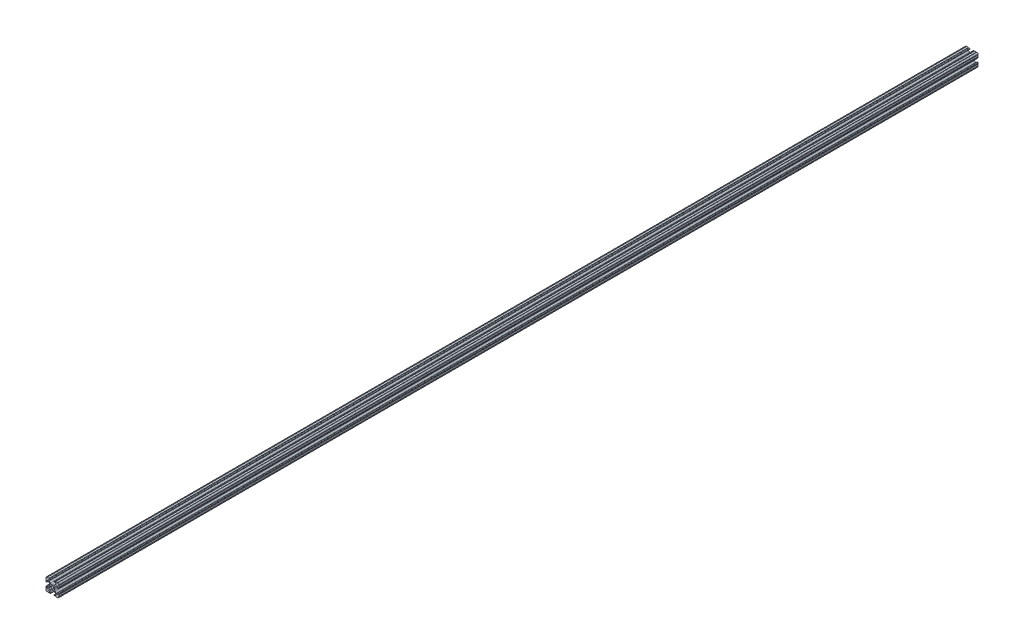
from build123d import *

# Parameters (mm, degrees)
SKETCH1_R               = 2.6035
BOSS_EXTRUDE1_DEPTH     = 914.4
CUT_EXTRUDE1_DEPTH      = 915.65008745
CUT_EXTRUDE1_DEPTH_BACK = 915.65008745
SKETCH2_R               = 3.175


with BuildPart() as part:
    # Sketch1 → Boss-Extrude1 (new, symmetric)
    with BuildSketch(Plane.XY):
        with BuildLine():
            Line((-7.179650497, -8.645192506), (-3.952270251, -5.423690499))
            ThreePointArc((-3.952270251, -5.423690499), (-2.922936451, -4.736929036), (-1.709253557, -4.4958))
            Line((-1.709253557, -4.4958), (1.709253557, -4.4958))
            ThreePointArc((1.709253557, -4.4958), (2.922936451, -4.736929036), (3.952270251, -5.423690499))
            Line((3.952270251, -5.423690499), (7.179650497, -8.645192506))
            ThreePointArc((7.179650497, -8.645192506), (7.41473083, -9.822813117), (6.416408329, -10.4902))
            Line((6.416408329, -10.4902), (4.287512407, -10.4902))
            ThreePointArc((4.287512407, -10.4902), (3.54574862, -10.79744862), (3.2385, -11.539212407))
            Line((3.2385, -11.539212407), (3.2385, -11.650987593))
            ThreePointArc((3.2385, -11.650987593), (3.54574862, -12.39275138), (4.287512407, -12.7))
            Line((4.287512407, -12.7), (5.317126718, -12.7))
            ThreePointArc((5.317126718, -12.7), (5.825126718, -12.192), (6.333126718, -12.7))
            Line((6.333126718, -12.7), (9.550443118, -12.7))
            ThreePointArc((9.550443118, -12.7), (10.058366869, -12.192000006), (10.566443095, -12.699847501))
            ThreePointArc((10.566443095, -12.699847501), (12.082537762, -12.08250727), (12.699846982, -10.566399977))
            ThreePointArc((12.699846982, -10.566399977), (12.192000006, -10.058323491), (12.7, -9.5504))
            Line((12.7, -9.5504), (12.7, -6.3330836))
            ThreePointArc((12.7, -6.3330836), (12.192, -5.8250836), (12.7, -5.3170836))
            Line((12.7, -5.3170836), (12.7, -4.287469289))
            ThreePointArc((12.7, -4.287469289), (12.39275138, -3.545705502), (11.650987593, -3.238456882))
            Line((11.650987593, -3.238456882), (11.539212407, -3.238456882))
            ThreePointArc((11.539212407, -3.238456882), (10.79744862, -3.545705502), (10.4902, -4.287469289))
            Line((10.4902, -4.287469289), (10.4902, -6.402089023))
            ThreePointArc((10.4902, -6.402089023), (9.856505071, -7.351067942), (8.737131347, -7.129408934))
            Line((8.737131347, -7.129408934), (5.441005833, -3.840816462))
            ThreePointArc((5.441005833, -3.840816462), (4.750877967, -2.809883091), (4.5085, -1.593185507))
            Line((4.5085, -1.593185507), (4.5085, 1.593185507))
            ThreePointArc((4.5085, 1.593185507), (4.750877967, 2.809883091), (5.441005833, 3.840816462))
            Line((5.441005833, 3.840816462), (8.737131347, 7.129408934))
            ThreePointArc((8.737131347, 7.129408934), (9.856505071, 7.351067942), (10.4902, 6.402089023))
            Line((10.4902, 6.402089023), (10.4902, 4.287469289))
            ThreePointArc((10.4902, 4.287469289), (10.79744862, 3.545705502), (11.539212407, 3.238456882))
            Line((11.539212407, 3.238456882), (11.650987593, 3.238456882))
            ThreePointArc((11.650987593, 3.238456882), (12.39275138, 3.545705502), (12.7, 4.287469289))
            Line((12.7, 4.287469289), (12.7, 5.3170836))
            ThreePointArc((12.7, 5.3170836), (12.192, 5.8250836), (12.7, 6.3330836))
            Line((12.7, 6.3330836), (12.7, 9.5504))
            ThreePointArc((12.7, 9.5504), (12.192000006, 10.058323491), (12.699846982, 10.566399977))
            ThreePointArc((12.699846982, 10.566399977), (12.082537762, 12.08250727), (10.566443095, 12.699847501))
            ThreePointArc((10.566443095, 12.699847501), (10.058366869, 12.192000006), (9.550443118, 12.7))
            Line((9.550443118, 12.7), (6.333126718, 12.7))
            ThreePointArc((6.333126718, 12.7), (5.825126718, 12.192), (5.317126718, 12.7))
            Line((5.317126718, 12.7), (4.287512407, 12.7))
            ThreePointArc((4.287512407, 12.7), (3.54574862, 12.39275138), (3.2385, 11.650987593))
            Line((3.2385, 11.650987593), (3.2385, 11.539212407))
            ThreePointArc((3.2385, 11.539212407), (3.54574862, 10.79744862), (4.287512407, 10.4902))
            Line((4.287512407, 10.4902), (6.476788598, 10.4902))
            ThreePointArc((6.476788598, 10.4902), (7.432222385, 9.85140422), (7.207036008, 8.724370562))
            Line((7.207036008, 8.724370562), (3.898272566, 5.423169045))
            ThreePointArc((3.898272566, 5.423169045), (2.869120213, 4.736787962), (1.655778399, 4.4958))
            Line((1.655778399, 4.4958), (-1.655778399, 4.4958))
            ThreePointArc((-1.655778399, 4.4958), (-2.869120213, 4.736787962), (-3.898272566, 5.423169045))
            Line((-3.898272566, 5.423169045), (-7.207036008, 8.724370562))
            ThreePointArc((-7.207036008, 8.724370562), (-7.432222385, 9.85140422), (-6.476788598, 10.4902))
            Line((-6.476788598, 10.4902), (-4.287512407, 10.4902))
            ThreePointArc((-4.287512407, 10.4902), (-3.54574862, 10.79744862), (-3.2385, 11.539212407))
            Line((-3.2385, 11.539212407), (-3.2385, 11.650987593))
            ThreePointArc((-3.2385, 11.650987593), (-3.54574862, 12.39275138), (-4.287512407, 12.7))
            Line((-4.287512407, 12.7), (-5.317126718, 12.7))
            ThreePointArc((-5.317126718, 12.7), (-5.825126718, 12.192), (-6.333126718, 12.7))
            Line((-6.333126718, 12.7), (-9.550443118, 12.7))
            ThreePointArc((-9.550443118, 12.7), (-10.058366869, 12.192000006), (-10.566443095, 12.699847501))
            ThreePointArc((-10.566443095, 12.699847501), (-12.082537762, 12.08250727), (-12.699846982, 10.566399977))
            ThreePointArc((-12.699846982, 10.566399977), (-12.192000006, 10.058323491), (-12.7, 9.5504))
            Line((-12.7, 9.5504), (-12.7, 6.3330836))
            ThreePointArc((-12.7, 6.3330836), (-12.192, 5.8250836), (-12.7, 5.3170836))
            Line((-12.7, 5.3170836), (-12.7, 4.287469289))
            ThreePointArc((-12.7, 4.287469289), (-12.39275138, 3.545705502), (-11.650987593, 3.238456882))
            Line((-11.650987593, 3.238456882), (-11.539212407, 3.238456882))
            ThreePointArc((-11.539212407, 3.238456882), (-10.79744862, 3.545705502), (-10.4902, 4.287469289))
            Line((-10.4902, 4.287469289), (-10.4902, 6.402089023))
            ThreePointArc((-10.4902, 6.402089023), (-9.856505071, 7.351067942), (-8.737131347, 7.129408934))
            Line((-8.737131347, 7.129408934), (-5.441005833, 3.840816462))
            ThreePointArc((-5.441005833, 3.840816462), (-4.750877967, 2.809883091), (-4.5085, 1.593185507))
            Line((-4.5085, 1.593185507), (-4.5085, -1.593185507))
            ThreePointArc((-4.5085, -1.593185507), (-4.750877967, -2.809883091), (-5.441005833, -3.840816462))
            Line((-5.441005833, -3.840816462), (-8.737131347, -7.129408934))
            ThreePointArc((-8.737131347, -7.129408934), (-9.856505071, -7.351067942), (-10.4902, -6.402089023))
            Line((-10.4902, -6.402089023), (-10.4902, -4.287469289))
            ThreePointArc((-10.4902, -4.287469289), (-10.79744862, -3.545705502), (-11.539212407, -3.238456882))
            Line((-11.539212407, -3.238456882), (-11.650987593, -3.238456882))
            ThreePointArc((-11.650987593, -3.238456882), (-12.39275138, -3.545705502), (-12.7, -4.287469289))
            Line((-12.7, -4.287469289), (-12.7, -5.3170836))
            ThreePointArc((-12.7, -5.3170836), (-12.192, -5.8250836), (-12.7, -6.3330836))
            Line((-12.7, -6.3330836), (-12.7, -9.5504))
            ThreePointArc((-12.7, -9.5504), (-12.192000006, -10.058323491), (-12.699846982, -10.566399977))
            ThreePointArc((-12.699846982, -10.566399977), (-12.082537762, -12.08250727), (-10.566443095, -12.699847501))
            ThreePointArc((-10.566443095, -12.699847501), (-10.058366869, -12.192000006), (-9.550443118, -12.7))
            Line((-9.550443118, -12.7), (-6.333126718, -12.7))
            ThreePointArc((-6.333126718, -12.7), (-5.825126718, -12.192), (-5.317126718, -12.7))
            Line((-5.317126718, -12.7), (-4.287512407, -12.7))
            ThreePointArc((-4.287512407, -12.7), (-3.54574862, -12.39275138), (-3.2385, -11.650987593))
            Line((-3.2385, -11.650987593), (-3.2385, -11.539212407))
            ThreePointArc((-3.2385, -11.539212407), (-3.54574862, -10.79744862), (-4.287512407, -10.4902))
            Line((-4.287512407, -10.4902), (-6.416408329, -10.4902))
            ThreePointArc((-6.416408329, -10.4902), (-7.41473083, -9.822813117), (-7.179650497, -8.645192506))
        make_face()
        Circle(SKETCH1_R, mode=Mode.SUBTRACT)
    extrude(amount=BOSS_EXTRUDE1_DEPTH, both=True)

    # Sketch2 → Cut-Extrude1 (cut, two sides: drawn at the far end of the back side and taken through both)
    with BuildSketch(Plane(origin=(4.5085, 0, 0), x_dir=(0, 0, -1), z_dir=(1, 0, 0)).offset(-CUT_EXTRUDE1_DEPTH_BACK)):
        with Locations(Location((0, 0, 0), (0, 0, 149.88145664))):
            Circle(SKETCH2_R)
    extrude(amount=CUT_EXTRUDE1_DEPTH + CUT_EXTRUDE1_DEPTH_BACK, mode=Mode.SUBTRACT)


solid = part.part
